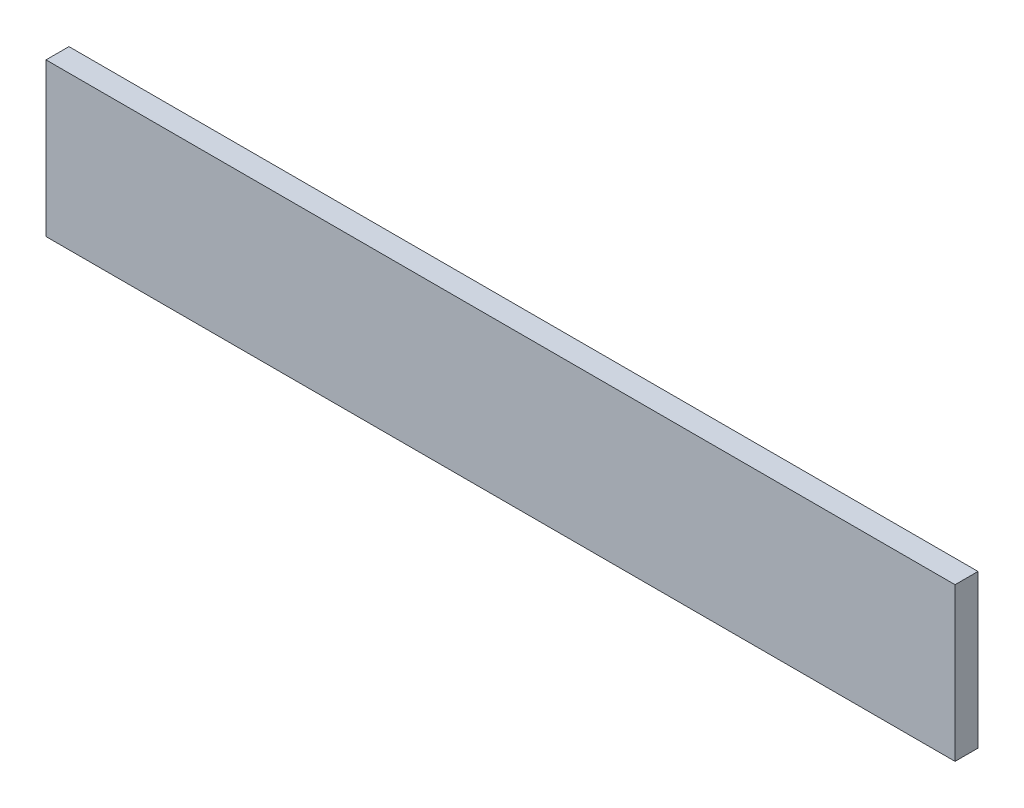
from build123d import *

# Parameters (mm, degrees)
CROQUIS1_W              = 15
CROQUIS1_H              = 100
SALIENTE_EXTRUIR1_DEPTH = 594


with BuildPart() as part:
    # Croquis1 → Saliente-Extruir1 (new body)
    with BuildSketch(Plane(origin=(0, 0, 0), x_dir=(0, 0, -1), z_dir=(1, 0, 0))):
        Rectangle(CROQUIS1_W, CROQUIS1_H)
    extrude(amount=SALIENTE_EXTRUIR1_DEPTH)


solid = part.part
